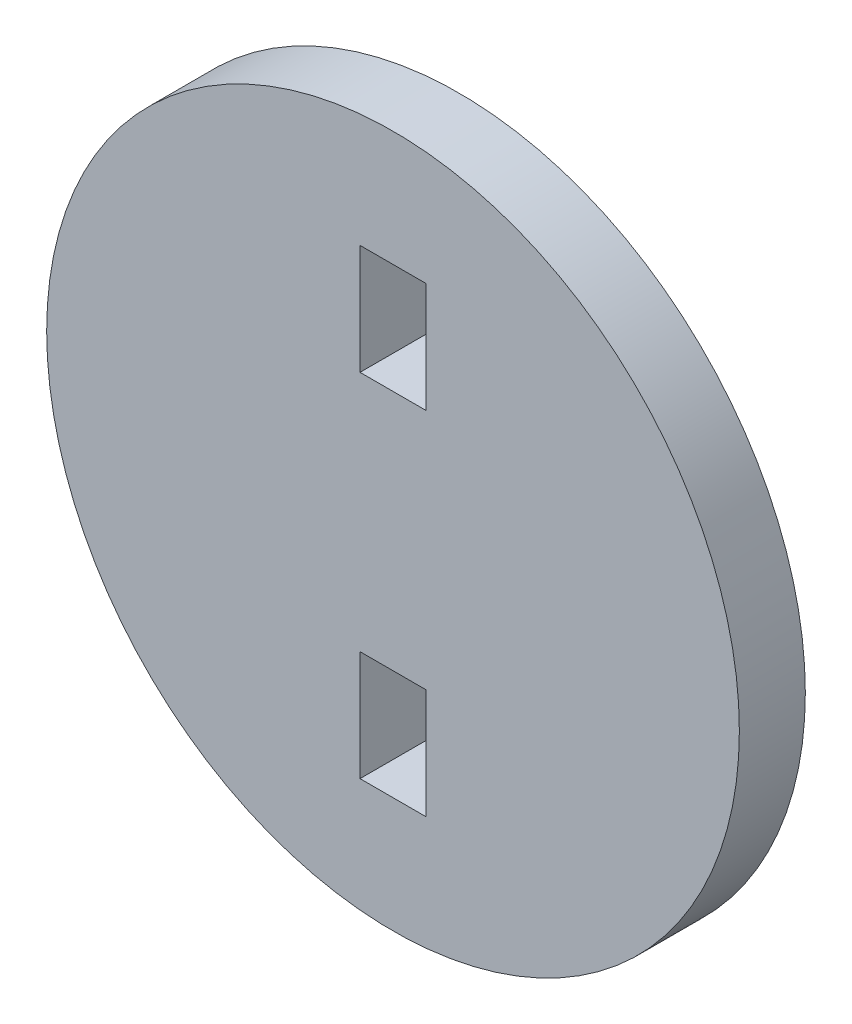
from build123d import *

# Parameters (mm, degrees)
ESQUISSE1_R        = 15.75
ESQUISSE1_W        = 3
ESQUISSE1_H        = 5
BOSS_EXTRU_1_DEPTH = 3


with BuildPart() as part:
    # Esquisse1 → Boss.-Extru.1 (new body)
    with BuildSketch(Plane.XY):
        Circle(ESQUISSE1_R)
        with Locations((0, 8)):
            Rectangle(ESQUISSE1_W, ESQUISSE1_H, mode=Mode.SUBTRACT)
        with Locations((0, -8)):
            Rectangle(ESQUISSE1_W, ESQUISSE1_H, mode=Mode.SUBTRACT)
    extrude(amount=BOSS_EXTRU_1_DEPTH)


solid = part.part
